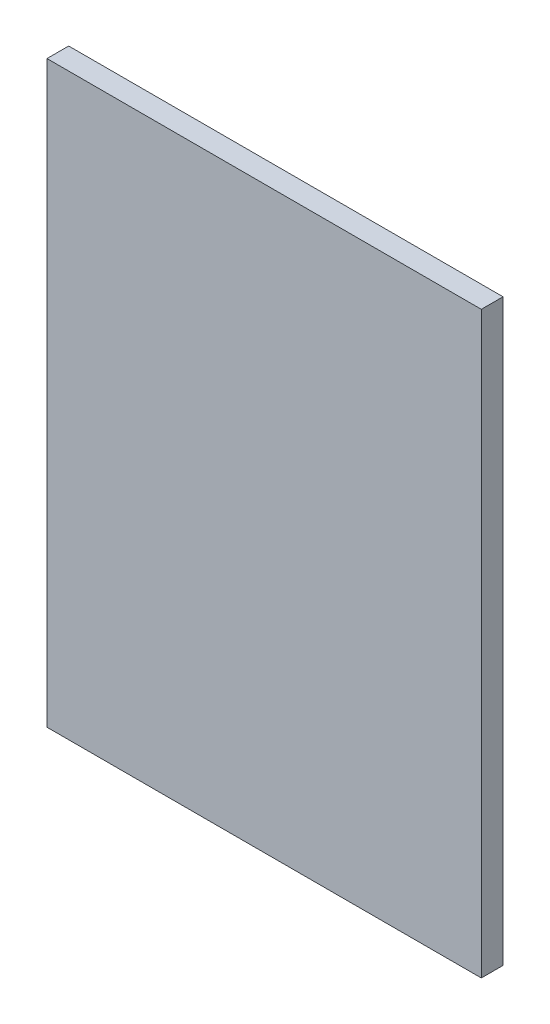
from build123d import *

# Parameters (mm, degrees)
SKETCH1_W           = 60
SKETCH1_H           = 80
BOSS_EXTRUDE1_DEPTH = 3


with BuildPart() as part:
    # Sketch1 → Boss-Extrude1 (new body)
    with BuildSketch(Plane.XY):
        with Locations((30, -40)):
            Rectangle(SKETCH1_W, SKETCH1_H)
    extrude(amount=BOSS_EXTRUDE1_DEPTH)


solid = part.part
